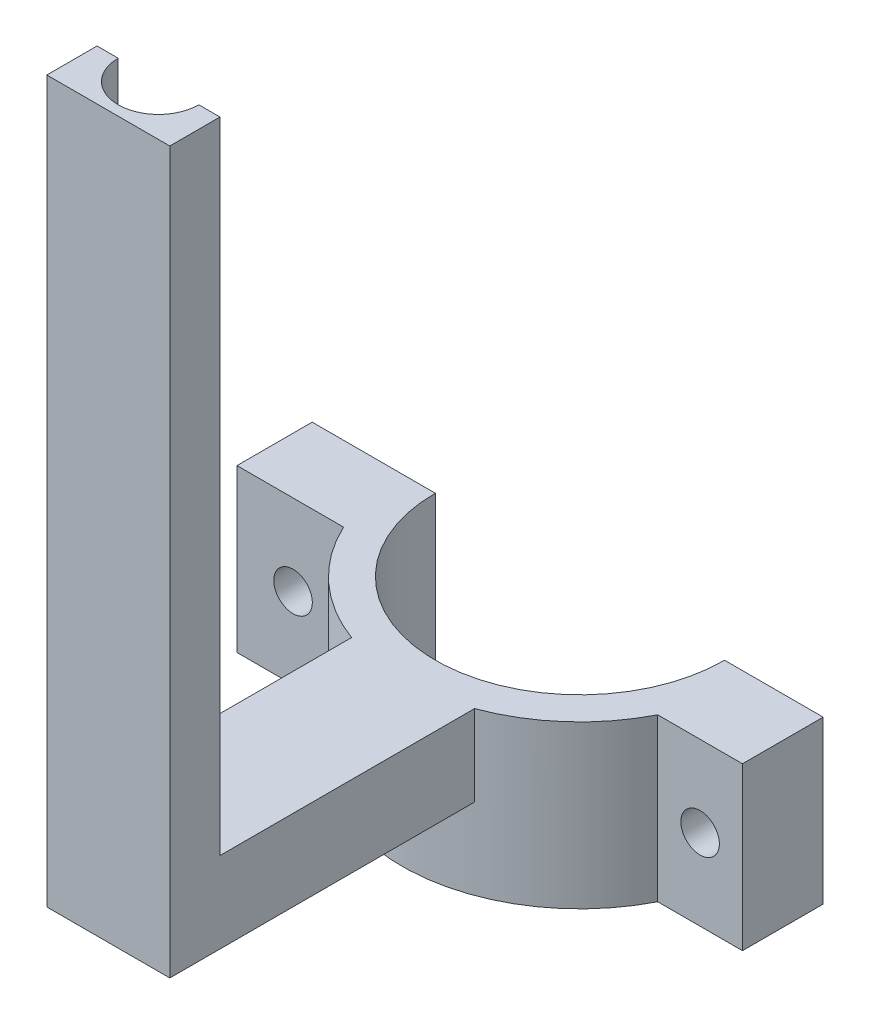
from build123d import *

# Parameters (mm, degrees)
SKETCH_1_R             = 17.63
SKETCH_1_R_2           = 14.34
EXTRUDE_1_DEPTH        = 16.05
EXTRUDE_1_2_DEPTH      = 9.77
EXTRUDE_1_2_DEPTH_BACK = 3
SKETCH_2_W             = 16
SKETCH_2_H             = 16.05
SKETCH_3_W             = 3.41
SKETCH_3_H             = 16
CUT_EXTRUDE_1_DEPTH    = 37.411121927
SKETCH_4_R             = 1.91
CUT_EXTRUDE_2_DEPTH    = 39.675463798
EXTRUDE_2_DEPTH        = 4
EXTRUDE_2_DEPTH_BACK   = 2.77
SKETCH_5_W             = 12.19
SKETCH_5_H             = 8.263625949
SKETCH_6_W             = 12.19
SKETCH_6_H             = 6.77
EXTRUDE_3_DEPTH        = 63
SKETCH_8_W             = 12.19
SKETCH_8_H             = 6.77
EXTRUDE_4_DEPTH        = 0.16
EXTRUDE_5_DEPTH        = 3.16
EXTRUDE_5_DEPTH_BACK   = 10
SKETCH_12_W            = 16
SKETCH_12_H            = 16.05
SKETCH_13_W            = 1.21
SKETCH_13_H            = 16
CUT_EXTRUDE_3_DEPTH    = 73.543164889
SKETCH_14_R            = 1.91
CUT_EXTRUDE_4_DEPTH    = 90.07387176
SKETCH_15_R            = 4.05
CUT_EXTRUDE_5_DEPTH    = 24
SKETCH_16_W            = 56.400519221
SKETCH_16_H            = 19.935010357
CUT_EXTRUDE_6_DEPTH    = 73.088971918
SKETCH_17_W            = 12.19
SKETCH_17_H            = 71.423625949
EXTRUDE_7_DEPTH        = 25
SKETCH_18_W            = 26.793372528
SKETCH_18_H            = 63.398625949
CUT_EXTRUDE_7_DEPTH    = 25
SKETCH_19_R            = 4
CUT_EXTRUDE_8_DEPTH    = 24


with BuildPart() as part:
    # 草圖1 → Extrude 1 (new body)
    with BuildSketch(Plane(origin=(0, 0, 0), x_dir=(1, 0, 0), z_dir=(0, 1, 0))):
        Circle(SKETCH_1_R)
        Circle(SKETCH_1_R_2, mode=Mode.SUBTRACT)
    extrude(amount=EXTRUDE_1_DEPTH)

    # 草圖2 → Extrude 1 2 (add, two sides: drawn at the far end of the back side and taken through both)
    with BuildSketch(Plane(origin=(17.75, 0, 0), x_dir=(0, 0, -1), z_dir=(1, 0, 0)).offset(-EXTRUDE_1_2_DEPTH_BACK)):
        with Locations((0, 8.025)):
            Rectangle(SKETCH_2_W, SKETCH_2_H)
    extrude(amount=EXTRUDE_1_2_DEPTH + EXTRUDE_1_2_DEPTH_BACK)

    # 草圖3 → 除料-伸長1 (cut, through all)
    with BuildSketch(Plane(origin=(0, 16.05, 0), x_dir=(1, 0, 0), z_dir=(0, 1, 0))):
        with Locations((25.815, 0)):
            Rectangle(SKETCH_3_W, SKETCH_3_H)
    extrude(amount=-CUT_EXTRUDE_1_DEPTH, mode=Mode.SUBTRACT)

    # 草圖4 → 除料-伸長2 (cut, through all)
    with BuildSketch(Plane.XY.offset(8)):
        with Locations((19.910203689, 8.025)):
            Circle(SKETCH_4_R)
    extrude(amount=-CUT_EXTRUDE_2_DEPTH, mode=Mode.SUBTRACT)

    # 草圖5 → 填料-伸長2 (add, two sides: drawn at the far end of the back side and taken through both)
    with BuildSketch(Plane.XY.offset(17.75).offset(-EXTRUDE_2_DEPTH_BACK)):
        with Locations((0, 12.156812974)):
            Rectangle(SKETCH_5_W, SKETCH_5_H)
    extrude(amount=EXTRUDE_2_DEPTH + EXTRUDE_2_DEPTH_BACK)

    # 草圖6 → 填料-伸長3 (add)
    with BuildSketch(Plane(origin=(0, 16.288625949, 0), x_dir=(1, 0, 0), z_dir=(0, 1, 0))):
        with Locations((0, -18.365)):
            Rectangle(SKETCH_6_W, SKETCH_6_H)
    extrude(amount=EXTRUDE_3_DEPTH)

    # 草圖8 → 填料-伸長4 (add)
    with BuildSketch(Plane(origin=(0, 79.288625949, 0), x_dir=(1, 0, 0), z_dir=(0, 1, 0))):
        with Locations((0, -18.365)):
            Rectangle(SKETCH_8_W, SKETCH_8_H)
    extrude(amount=EXTRUDE_4_DEPTH)

    # 草圖12 → 填料-伸長5 (add, two sides: drawn at the far end of the back side and taken through both)
    with BuildSketch(Plane(origin=(-17.75, 0, 0), x_dir=(0, 0, -1), z_dir=(1, 0, 0)).offset(-EXTRUDE_5_DEPTH_BACK)):
        with Locations((0.543544944, 8.025)):
            Rectangle(SKETCH_12_W, SKETCH_12_H)
    extrude(amount=EXTRUDE_5_DEPTH + EXTRUDE_5_DEPTH_BACK)

    # 草圖13 → 除料-伸長3 (cut, through all)
    with BuildSketch(Plane(origin=(0, 16.05, 0), x_dir=(1, 0, 0), z_dir=(0, 1, 0))):
        with Locations((-27.145, 0.543544944)):
            Rectangle(SKETCH_13_W, SKETCH_13_H)
    extrude(amount=-CUT_EXTRUDE_3_DEPTH, mode=Mode.SUBTRACT)

    # 草圖14 → 除料-伸長4 (cut, through all)
    with BuildSketch(Plane(origin=(0, 0, -8.543544944), x_dir=(-1, 0, 0), z_dir=(0, 0, -1))):
        with Locations(Location((20.980783679, 8.025, 0), (0, 0, 90))):
            Circle(SKETCH_14_R)
    extrude(amount=-CUT_EXTRUDE_4_DEPTH, mode=Mode.SUBTRACT)

    # 草圖15 → 除料-伸長5 (cut)
    with BuildSketch(Plane(origin=(0, 79.448625949, 0), x_dir=(1, 0, 0), z_dir=(0, 1, 0))):
        with Locations((0, -14.98)):
            Circle(SKETCH_15_R)
    extrude(amount=-CUT_EXTRUDE_5_DEPTH, mode=Mode.SUBTRACT)

    # 草圖16 → 除料-伸長6 (cut, through all)
    with BuildSketch(Plane(origin=(0, 16.05, 0), x_dir=(1, 0, 0), z_dir=(0, 1, 0))):
        with Locations((-4.090259611, 9.967505179)):
            Rectangle(SKETCH_16_W, SKETCH_16_H)
    extrude(amount=-CUT_EXTRUDE_6_DEPTH, mode=Mode.SUBTRACT)

    # 草圖17 → 填料-伸長7 (add)
    with BuildSketch(Plane.XY.offset(21.75)):
        with Locations((0, 43.736812975)):
            Rectangle(SKETCH_17_W, SKETCH_17_H)
    extrude(amount=EXTRUDE_7_DEPTH)

    # 草圖18 → 除料-伸長7 (cut)
    with BuildSketch(Plane.ZY.offset(6.095)):
        with Locations((28.376686264, 47.749312975)):
            Rectangle(SKETCH_18_W, SKETCH_18_H)
    extrude(amount=-CUT_EXTRUDE_7_DEPTH, mode=Mode.SUBTRACT)

    # 草圖19 → 除料-伸長8 (cut)
    with BuildSketch(Plane(origin=(0, 79.448625949, 0), x_dir=(1, 0, 0), z_dir=(0, 1, 0))):
        with Locations((0, -41.773372528)):
            Circle(SKETCH_19_R)
    extrude(amount=-CUT_EXTRUDE_8_DEPTH, mode=Mode.SUBTRACT)


solid = part.part
